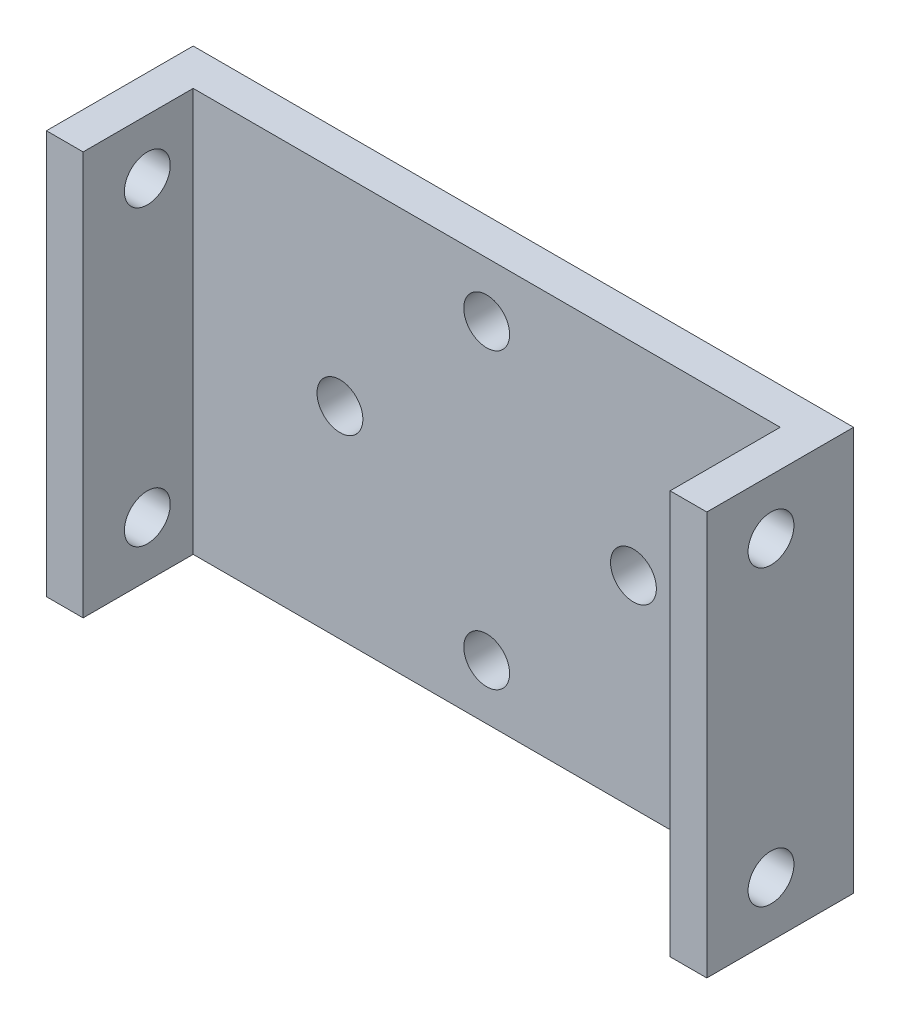
from build123d import *

# Parameters (mm, degrees)
ESBO_O1_W                = 36
ESBO_O1_H                = 22
ESBO_O1_R                = 1.25
RESSALTO_EXTRUS_O1_DEPTH = 2
ESBO_O2_W                = 2
ESBO_O2_H                = 22
RESSALTO_EXTRUS_O2_DEPTH = 6
CORTE_EXTRUS_O1_REACH    = 40.484
ESBO_O3_R                = 1.25


with BuildPart() as part:
    # Esboço1 → Ressalto-extrusão1 (new body)
    with BuildSketch(Plane.XY):
        Rectangle(ESBO_O1_W, ESBO_O1_H)
        with Locations((0, 8)):
            Circle(ESBO_O1_R, mode=Mode.SUBTRACT)
        with Locations((8, 0)):
            Circle(ESBO_O1_R, mode=Mode.SUBTRACT)
        with Locations((0, -8)):
            Circle(ESBO_O1_R, mode=Mode.SUBTRACT)
        with Locations((-8, 0)):
            Circle(ESBO_O1_R, mode=Mode.SUBTRACT)
    extrude(amount=RESSALTO_EXTRUS_O1_DEPTH)

    # Esboço2 → Ressalto-extrusão2 (add)
    with BuildSketch(Plane.XY.offset(2)):
        with Locations((-17, 0)):
            Rectangle(ESBO_O2_W, ESBO_O2_H)
        with Locations((17, 0)):
            Rectangle(ESBO_O2_W, ESBO_O2_H)
    extrude(amount=RESSALTO_EXTRUS_O2_DEPTH)

    # Corte-extrusão1: up to this face of the body (flat: up to its plane)
    corte_extrus_o1_end = Plane(part.part.faces().sort_by_distance((18, 0, 4))[0])
    # Esboço3 → Corte-extrusão1 (cut, up to the picked face)
    with BuildSketch(Plane.ZY.offset(18), mode=Mode.PRIVATE) as corte_extrus_o1_sk1:
        with Locations((4.5, 8)):
            Circle(ESBO_O3_R)
    corte_extrus_o1_tool1 = split(extrude(corte_extrus_o1_sk1.sketch, amount=-CORTE_EXTRUS_O1_REACH, mode=Mode.PRIVATE), bisect_by=corte_extrus_o1_end, keep=Keep.BOTH, mode=Mode.PRIVATE)
    # Esboço3 → Corte-extrusão1 (cut, up to the picked face)
    with BuildSketch(Plane.ZY.offset(18), mode=Mode.PRIVATE) as corte_extrus_o1_sk2:
        with Locations((4.5, -8)):
            Circle(ESBO_O3_R)
    corte_extrus_o1_tool2 = split(extrude(corte_extrus_o1_sk2.sketch, amount=-CORTE_EXTRUS_O1_REACH, mode=Mode.PRIVATE), bisect_by=corte_extrus_o1_end, keep=Keep.BOTH, mode=Mode.PRIVATE)
    add(corte_extrus_o1_tool1.solids().sort_by(Axis((-18, 8, 4.5), (1, 0, 0)))[0], mode=Mode.SUBTRACT)
    add(corte_extrus_o1_tool2.solids().sort_by(Axis((-18, -8, 4.5), (1, 0, 0)))[0], mode=Mode.SUBTRACT)


solid = part.part
